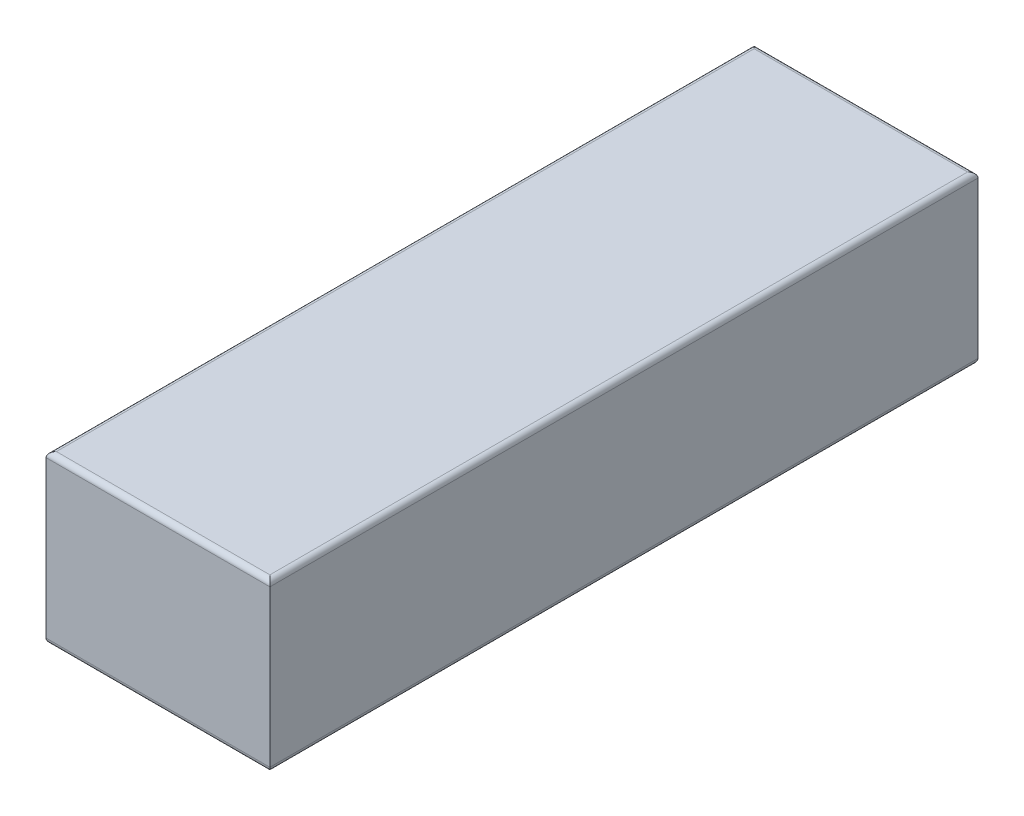
from build123d import *

# Parameters (mm, degrees)
SKETCH_1_W      = 43
SKETCH_1_H      = 136
EXTRUDE_1_DEPTH = 32
FILLET_1_R      = 1


with BuildPart() as part:
    # 草图1 → 凸台-拉伸1 (new body)
    with BuildSketch(Plane(origin=(0, 0, 0), x_dir=(1, 0, 0), z_dir=(0, 1, 0))):
        Rectangle(SKETCH_1_W, SKETCH_1_H)
    extrude(amount=EXTRUDE_1_DEPTH)

    # 圆角1
    fillet_1_edges = [part.edges().sort_by_distance(p)[0] for p in [
        (-21.5, 32, 0),
        (0, 32, 68),
        (21.5, 32, 0),
        (0, 0, 68),
        (-21.5, 0, 0),
        (0, 0, -68),
        (21.5, 0, 0),
        (0, 32, -68),
    ]]
    fillet(fillet_1_edges, radius=FILLET_1_R)


solid = part.part
